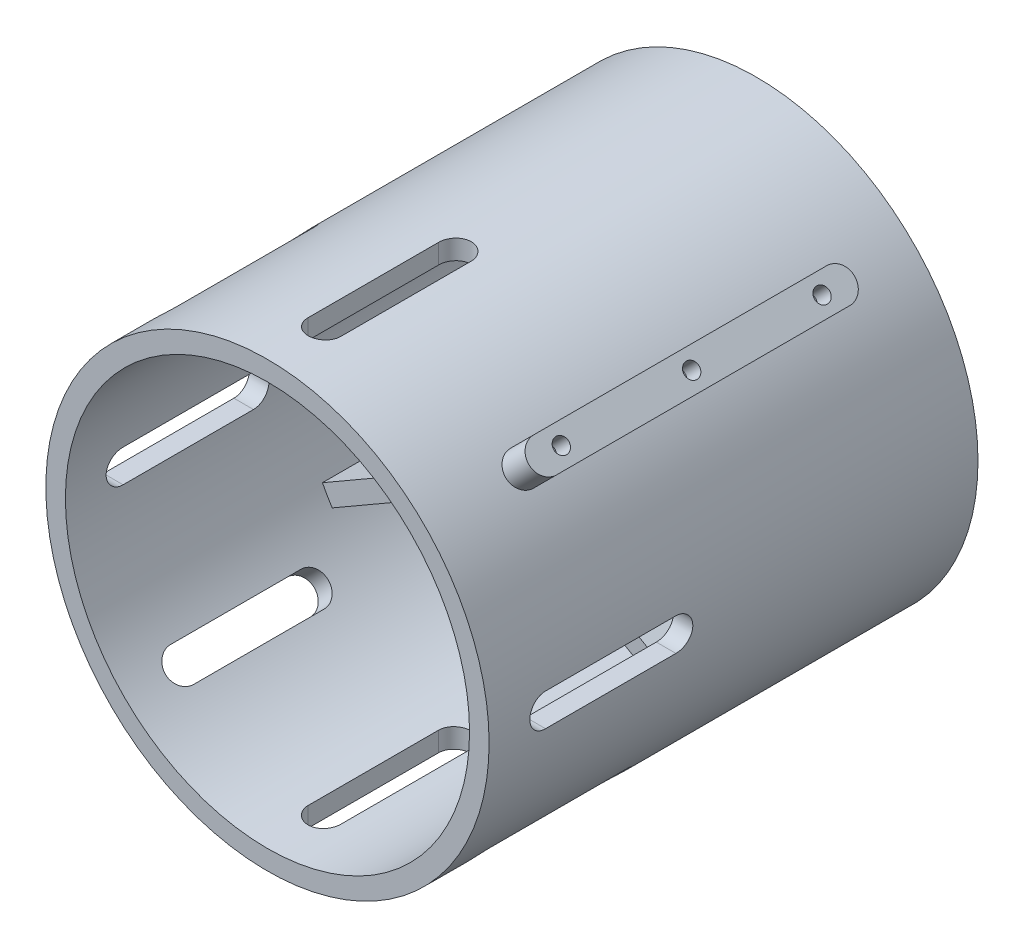
from build123d import *

# Parameters (mm, degrees)
SKETCH2_R                = 34
SKETCH2_R_2              = 31
BOSS_EXTRUDE1_DEPTH      = 75
BOSS_EXTRUDE2_DEPTH      = 1.5
BOSS_EXTRUDE2_DEPTH_BACK = 30
SKETCH3_R                = 12
CUT_EXTRUDE2_REACH       = 108.794
CUT_EXTRUDE2_END_RADIUS  = 31
CIRPATTERN1_COUNT        = 7
CIRPATTERN1_ANGLE        = 270
SKETCH6_R                = 1.15
BOSS_EXTRUDE4_DEPTH      = 5
SKETCH7_R                = 1.15
BOSS_EXTRUDE5_DEPTH      = 2


with BuildPart() as part:
    # Sketch2 → Boss-Extrude1 (new body)
    with BuildSketch(Plane.XY):
        Circle(SKETCH2_R)
        Circle(SKETCH2_R_2, mode=Mode.SUBTRACT)
    extrude(amount=BOSS_EXTRUDE1_DEPTH)

    # Sketch3 → Boss-Extrude2 (add, two sides: drawn at the far end of the back side and taken through both)
    with BuildSketch(Plane.XY.offset(37.5).offset(-BOSS_EXTRUDE2_DEPTH_BACK)):
        with BuildLine():
            ThreePointArc((12.175265955, -8.761443884), (0, -15), (-12.175265955, -8.761443884))
            Line((-12.175265955, -8.761443884), (-26.096787517, -16.799038106))
            ThreePointArc((-26.096787517, -16.799038106), (-26.878197484, -15.518134553), (-27.596787517, -14.200961894))
            Line((-27.596787517, -14.200961894), (-13.675265955, -6.163367673))
            ThreePointArc((-13.675265955, -6.163367673), (-12.990381057, 7.5), (-1.5, 14.924811557))
            Line((-1.5, 14.924811557), (-1.5, 30.963688411))
            ThreePointArc((-1.5, 30.963688411), (0, 31), (1.5, 30.963688411))
            Line((1.5, 30.963688411), (1.5, 14.924811557))
            ThreePointArc((1.5, 14.924811557), (12.990381057, 7.5), (13.675265955, -6.163367673))
            Line((13.675265955, -6.163367673), (27.596787517, -14.200961894))
            ThreePointArc((27.596787517, -14.200961894), (26.878197484, -15.518134553), (26.096787517, -16.799038106))
            Line((26.096787517, -16.799038106), (12.175265955, -8.761443884))
        make_face()
        Circle(SKETCH3_R, mode=Mode.SUBTRACT)
    extrude(amount=BOSS_EXTRUDE2_DEPTH + BOSS_EXTRUDE2_DEPTH_BACK)

    # Cut-Extrude2: up to this cylinder (the profile starts outside it)
    cut_extrude2_end = Plane(origin=(0, 0, 56.25), z_dir=(0, 0, -1)) * Cylinder(CUT_EXTRUDE2_END_RADIUS, 280.588, mode=Mode.PRIVATE)
    # Sketch5 → Cut-Extrude2 (cut, up to the surface)
    with BuildSketch(Plane(origin=(34, 0, 0), x_dir=(0, 0, -1), z_dir=(1, 0, 0)), mode=Mode.PRIVATE) as cut_extrude2_sk1:
        with BuildLine():
            Line((-66.25, 2.5), (-46.25, 2.5))
            ThreePointArc((-46.25, 2.5), (-43.75, 0), (-46.25, -2.5))
            Line((-46.25, -2.5), (-66.25, -2.5))
            ThreePointArc((-66.25, -2.5), (-68.75, 0), (-66.25, 2.5))
        make_face()
    cut_extrude2_tool1 = extrude(cut_extrude2_sk1.sketch, amount=-CUT_EXTRUDE2_REACH, mode=Mode.PRIVATE) - cut_extrude2_end
    cut_extrude2 = cut_extrude2_tool1.solids().sort_by_distance((34, 0, 56.25))[0]
    add(cut_extrude2, mode=Mode.SUBTRACT)

    # CirPattern1: Cut-Extrude2 ×7 about axis
    cirpattern1_axis = Axis((0, 0, 0), (0, 0, -1))
    for i in range(1, CIRPATTERN1_COUNT):
        add(cut_extrude2.rotate(cirpattern1_axis, i * CIRPATTERN1_ANGLE / (CIRPATTERN1_COUNT - 1)), mode=Mode.SUBTRACT)


with BuildPart() as body_2:
    # Sketch6 → Boss-Extrude4 (new body)
    with BuildSketch(Plane(origin=(24.04163056, 24.04163056, 0), x_dir=(0, 0, -1), z_dir=(0.7071067811865488, 0.7071067811865464, 0))):
        with BuildLine():
            Line((-60, 2.5), (-15, 2.5))
            ThreePointArc((-15, 2.5), (-12.5, 0), (-15, -2.5))
            Line((-15, -2.5), (-60, -2.5))
            ThreePointArc((-60, -2.5), (-62.5, 0), (-60, 2.5))
        make_face()
        with Locations(Location((-37.5, 0, 0), (0, 0, 90))):
            Circle(SKETCH6_R, mode=Mode.SUBTRACT)
        with Locations(Location((-57.5, 0, 0), (0, 0, 90))):
            Circle(SKETCH6_R, mode=Mode.SUBTRACT)
        with Locations(Location((-17.5, 0, 0), (0, 0, 270))):
            Circle(SKETCH6_R, mode=Mode.SUBTRACT)
    extrude(amount=BOSS_EXTRUDE4_DEPTH)

    # Sketch7 → Boss-Extrude5 (add)
    with BuildSketch(Plane(origin=(24.04163056, 24.04163056, 0), x_dir=(0, 0, -1), z_dir=(0.7071067811865488, 0.7071067811865464, 0))):
        with Locations(Location((-57.5, 0, 0), (0, 0, 90))):
            Circle(SKETCH7_R)
        with Locations(Location((-37.5, 0, 0), (0, 0, 90))):
            Circle(SKETCH7_R)
        with Locations(Location((-17.5, 0, 0), (0, 0, 270))):
            Circle(SKETCH7_R)
    extrude(amount=BOSS_EXTRUDE5_DEPTH)


solid = Compound([part.part, body_2.part])
